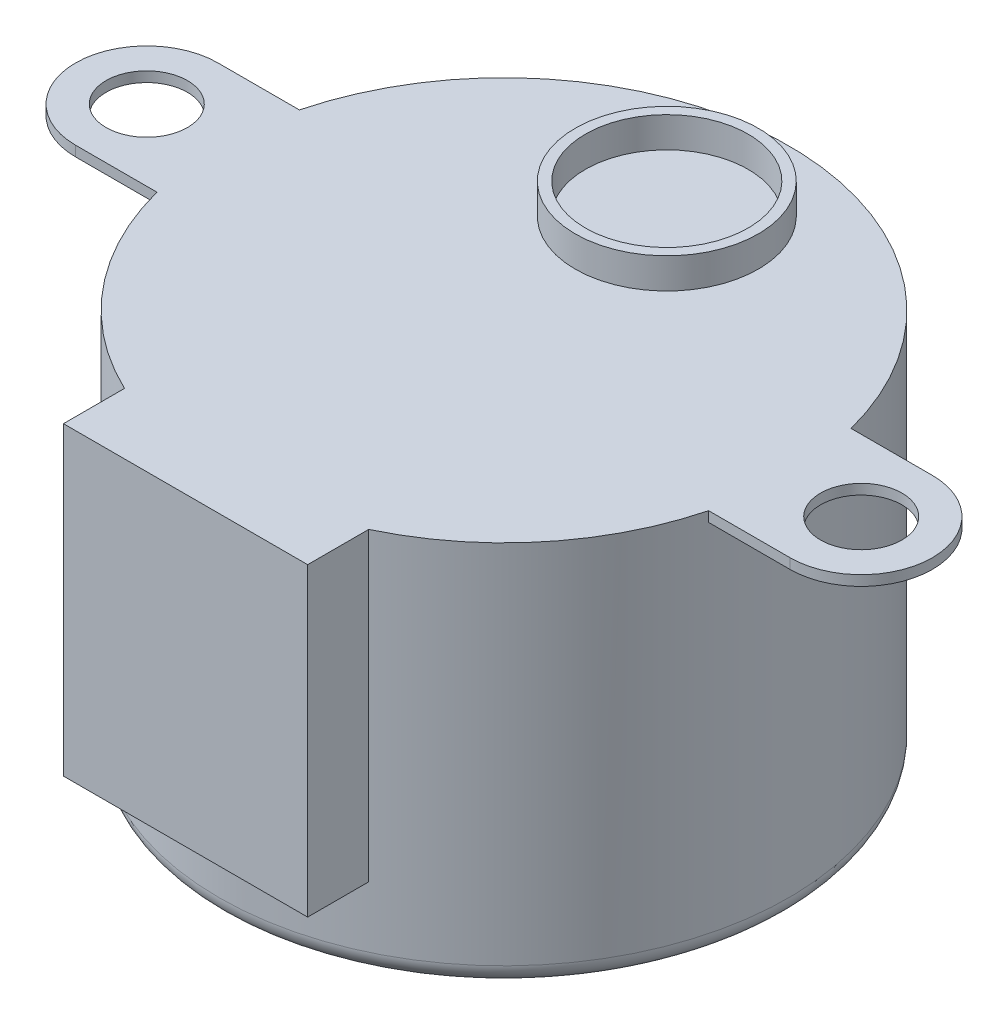
from build123d import *

# Parameters (mm, degrees)
SKETCH_1_R                       = 14
EXTRUDE_1_DEPTH                  = 19
SKETCH_2_R                       = 4.5
EXTRUDE_2_DEPTH                  = 1.5
SKETCH_3_R                       = 4
CUT_EXTRUDE_1_DEPTH              = 1.5
EXTRUDE_START                    = -0.5
EXTRUDE_3_DEPTH                  = 0.5
SKETCH_5_R                       = 2
CUT_EXTRUDE_2_DEPTH              = 32.628019629
EXTRUDE_START_2                  = -15
EXTRUDE_4_DEPTH                  = 15
FILLET_1_R                       = 1
CUT_EXTRUDE_3_DEPTH              = 1
FILLET_2_R                       = 0.3
PATTERN_CIRCULAR_1_COUNT         = 8
FILLET_2_OF_PATTERN_CIRCULAR_1_R = 0.3


with BuildPart() as part:
    # 草图1 → 凸台-拉伸1 (new body)
    with BuildSketch(Plane(origin=(0, 0, 0), x_dir=(1, 0, 0), z_dir=(0, 1, 0))):
        with Locations(Location((0, 0, 0), (0, 0, 270))):
            Circle(SKETCH_1_R)
    extrude(amount=EXTRUDE_1_DEPTH)

    # 草图2 → 凸台-拉伸2 (add)
    with BuildSketch(Plane(origin=(0, 19, 0), x_dir=(1, 0, 0), z_dir=(0, 1, 0))):
        with Locations(Location((0, 8, 0), (0, 0, 270))):
            Circle(SKETCH_2_R)
    extrude(amount=EXTRUDE_2_DEPTH)

    # 草图3 → 切除-拉伸1 (cut)
    with BuildSketch(Plane(origin=(0, 20.5, 0), x_dir=(1, 0, 0), z_dir=(0, 1, 0))):
        with Locations(Location((0, 8, 0), (0, 0, 270))):
            Circle(SKETCH_3_R)
    extrude(amount=-CUT_EXTRUDE_1_DEPTH, mode=Mode.SUBTRACT)

    # 草图4 → 凸台-拉伸3 (add)
    with BuildSketch(Plane(origin=(0, 19, 0), x_dir=(1, 0, 0), z_dir=(0, 1, 0)).offset(EXTRUDE_START)):
        with BuildLine():
            Line((-13.555441712, 3.5), (-17.555441712, 3.5))
            ThreePointArc((-17.555441712, 3.5), (-21.055441712, 0), (-17.555441712, -3.5))
            Line((-17.555441712, -3.5), (-13.555441712, -3.5))
            ThreePointArc((-13.555441712, -3.5), (-14, 0), (-13.555441712, 3.5))
        make_face()
        with BuildLine():
            Line((13.555441712, 3.5), (17.555441712, 3.5))
            ThreePointArc((17.555441712, 3.5), (21.055441712, 0), (17.555441712, -3.5))
            Line((17.555441712, -3.5), (13.555441712, -3.5))
            ThreePointArc((13.555441712, -3.5), (14, 0), (13.555441712, 3.5))
        make_face()
    extrude(amount=EXTRUDE_3_DEPTH)

    # 草图5 → 切除-拉伸2 (cut, through all)
    with BuildSketch(Plane(origin=(0, 19, 0), x_dir=(1, 0, 0), z_dir=(0, 1, 0))):
        with Locations(Location((-17.555441712, 0, 0), (0, 0, 270))):
            Circle(SKETCH_5_R)
        with Locations(Location((17.555441712, 0, 0), (0, 0, 90))):
            Circle(SKETCH_5_R)
    extrude(amount=-CUT_EXTRUDE_2_DEPTH, mode=Mode.SUBTRACT)

    # 草图6 → 凸台-拉伸4 (add)
    with BuildSketch(Plane(origin=(0, 19, 0), x_dir=(1, 0, 0), z_dir=(0, 1, 0)).offset(EXTRUDE_START_2)):
        with BuildLine():
            Line((-6, -12.649110641), (-6, -15.649110641))
            Line((-6, -15.649110641), (6, -15.649110641))
            Line((6, -15.649110641), (6, -12.649110641))
            ThreePointArc((6, -12.649110641), (0, -14), (-6, -12.649110641))
        make_face()
    extrude(amount=EXTRUDE_4_DEPTH)

    # 圆角1
    fillet_1_edges = [part.edges().sort_by_distance(p)[0] for p in [
        (0, 0, -14),
    ]]
    fillet(fillet_1_edges, radius=FILLET_1_R)

    # 草图7 → 切除-拉伸3 (cut)
    with BuildSketch(Plane.XZ):
        with BuildLine():
            Line((0.697808785, 4.951066845), (2.97689197, 8.493415932))
            ThreePointArc((2.97689197, 8.493415932), (3.444150891, 8.314915793), (3.900771502, 8.1107325))
            Line((3.900771502, 8.1107325), (3.007507616, 3.994358264))
            ThreePointArc((3.007507616, 3.994358264), (1.913417162, 4.619397663), (0.697808785, 4.951066845))
        make_face()
    cut_extrude_3 = extrude(amount=-CUT_EXTRUDE_3_DEPTH, mode=Mode.SUBTRACT)

    # 圆角2
    fillet_2_edges = [part.edges().sort_by_distance(p)[0] for p in [
        (2.97689197, 0.5, 8.493415932),
        (3.900771502, 0.5, 8.1107325),
    ]]
    fillet(fillet_2_edges, radius=FILLET_2_R)

    # 阵列(圆周)1: 切除-拉伸3 ×8 about axis
    pattern_circular_1_axis = Axis((-0.034019588, 0, -0.082130551), (0, 1, 0))
    for i in range(1, PATTERN_CIRCULAR_1_COUNT):
        add(cut_extrude_3.rotate(pattern_circular_1_axis, i * 360 / PATTERN_CIRCULAR_1_COUNT), mode=Mode.SUBTRACT)

    # 圆角2 of 阵列(圆周)1
    fillet_2_of_pattern_circular_1_edges = [part.edges().sort_by_distance(p)[0] for p in [
        (8.158843463, 0.5, 3.85266054),
        (8.541526895, 0.5, 2.928781007),
        (8.541526895, 0.5, -3.093042109),
        (8.158843463, 0.5, -4.016921641),
        (3.900771502, 0.5, -8.274993601),
        (2.97689197, 0.5, -8.657677034),
        (-3.044931146, 0.5, -8.657677034),
        (-3.968810678, 0.5, -8.274993601),
        (-8.226882639, 0.5, -4.016921641),
        (-8.609566071, 0.5, -3.093042109),
        (-8.609566071, 0.5, 2.928781007),
        (-8.226882639, 0.5, 3.85266054),
        (-3.968810678, 0.5, 8.1107325),
        (-3.044931146, 0.5, 8.493415932),
    ]]
    fillet(fillet_2_of_pattern_circular_1_edges, radius=FILLET_2_OF_PATTERN_CIRCULAR_1_R)


solid = part.part
